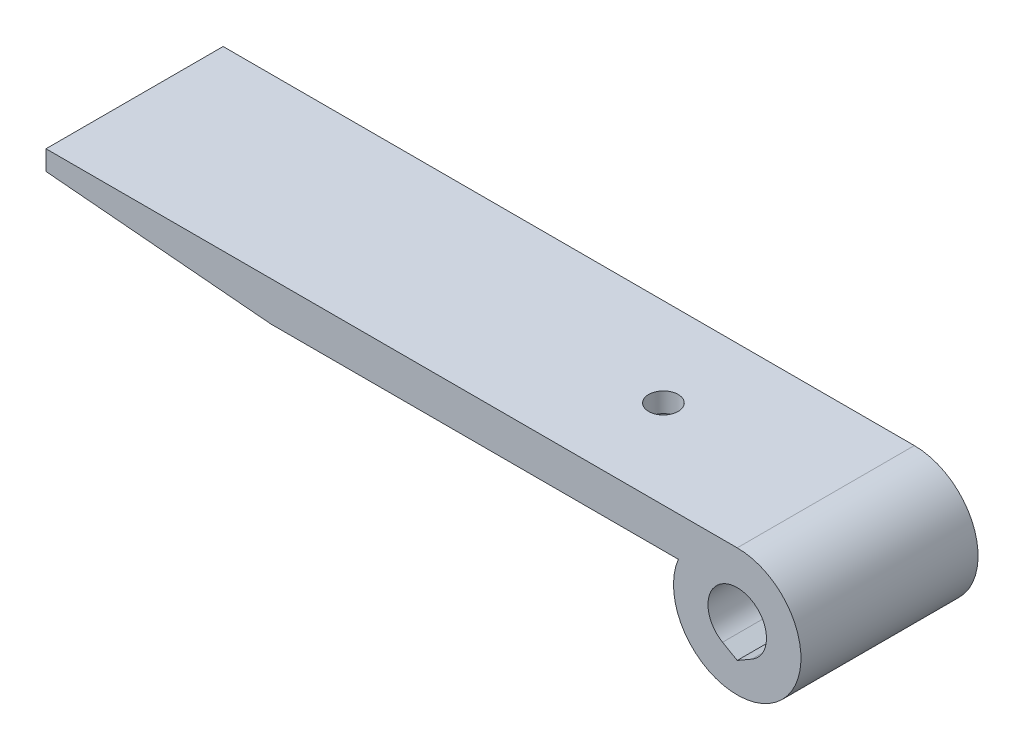
from build123d import *

# Parameters (mm, degrees)
MAIN_DEPTH          = 9
RIB_START           = -7
RIB_DEPTH           = 2
BOSS_EXTRUDE1_START = 9
BOSS_EXTRUDE1_DEPTH = 2
SKETCH2_R           = 1.5
CUT_EXTRUDE1_DEPTH  = 72.656236938
BOSS_EXTRUDE2_START = 4
SKETCH2_4_R         = 6.95
SKETCH2_4_R_2       = 4.05
SKETCH2_4_R_3       = 1.5
BOSS_EXTRUDE2_DEPTH = 4


with BuildPart() as part:
    # Sketch1 → main (new, symmetric)
    with BuildSketch(Plane.XY):
        with BuildLine():
            Line((0, 6.475), (-70.2404, 6.475))
            Line((-70.2404, 6.475), (-70.2404, 4.475))
            Line((-70.2404, 4.475), (-4.679743583, 4.475))
            ThreePointArc((-4.679743583, 4.475), (2.54460213, -5.954042744), (0, 6.475))
        make_face()
        with BuildLine():
            Line((1.4875, -2.576425576), (0, -3.435234102))
            Line((0, -3.435234102), (-1.4875, -2.576425576))
            ThreePointArc((-1.4875, -2.576425576), (0, 2.975), (1.4875, -2.576425576))
        make_face(mode=Mode.SUBTRACT)
    extrude(amount=MAIN_DEPTH, both=True)

    # Sketch1<4> → rib (add)
    with BuildSketch(Plane.XY.offset(RIB_START)):
        with BuildLine():
            Line((-47.380295394, 2.475), (-5.983310121, 2.475))
            ThreePointArc((-5.983310121, 2.475), (-5.424498002, 3.53559704), (-4.679743583, 4.475))
            Line((-4.679743583, 4.475), (-70.2404, 4.475))
            Line((-70.2404, 4.475), (-47.380295394, 2.475))
        make_face()
    extrude(amount=-RIB_DEPTH)

    # Sketch1<5> → Boss-Extrude1 (add)
    with BuildSketch(Plane.XY.offset(BOSS_EXTRUDE1_START)):
        with BuildLine():
            Line((-47.380295394, 2.475), (-5.983310121, 2.475))
            ThreePointArc((-5.983310121, 2.475), (-5.424498002, 3.53559704), (-4.679743583, 4.475))
            Line((-4.679743583, 4.475), (-70.2404, 4.475))
            Line((-70.2404, 4.475), (-47.380295394, 2.475))
        make_face()
    extrude(amount=-BOSS_EXTRUDE1_DEPTH)

    # Sketch2 → Cut-Extrude1 (cut, through all)
    with BuildSketch(Plane.XZ.offset(-4.475)):
        with Locations((-16.5, 0)):
            Circle(SKETCH2_R)
    extrude(amount=-CUT_EXTRUDE1_DEPTH, mode=Mode.SUBTRACT)

    # Sketch2<4> → Boss-Extrude2 (add)
    # profile 1 of 2: a face of its own
    with BuildSketch(Plane.XZ.offset(-4.475).offset(BOSS_EXTRUDE2_START)):
        with Locations(Location((-16.5, 0, 0), (0, 0, 180))):
            Circle(SKETCH2_4_R)
        with Locations((-16.5, 0)):
            Circle(SKETCH2_4_R_2, mode=Mode.SUBTRACT)
    # profile 2 of 2: a face of its own
    with BuildSketch(Plane.XZ.offset(-4.475).offset(BOSS_EXTRUDE2_START)):
        with Locations((-16.5, 0)):
            Circle(SKETCH2_4_R_3)
    extrude(amount=-BOSS_EXTRUDE2_DEPTH)


with BuildPart() as boss_extrude2_kept_piece:
    # of the separate pieces the step leaves, the one the design keeps (boss_extrude2_pieces_kept)
    add(part.part.solids().sort_by_distance((0, 6.475, -9))[0])


solid = boss_extrude2_kept_piece.part
